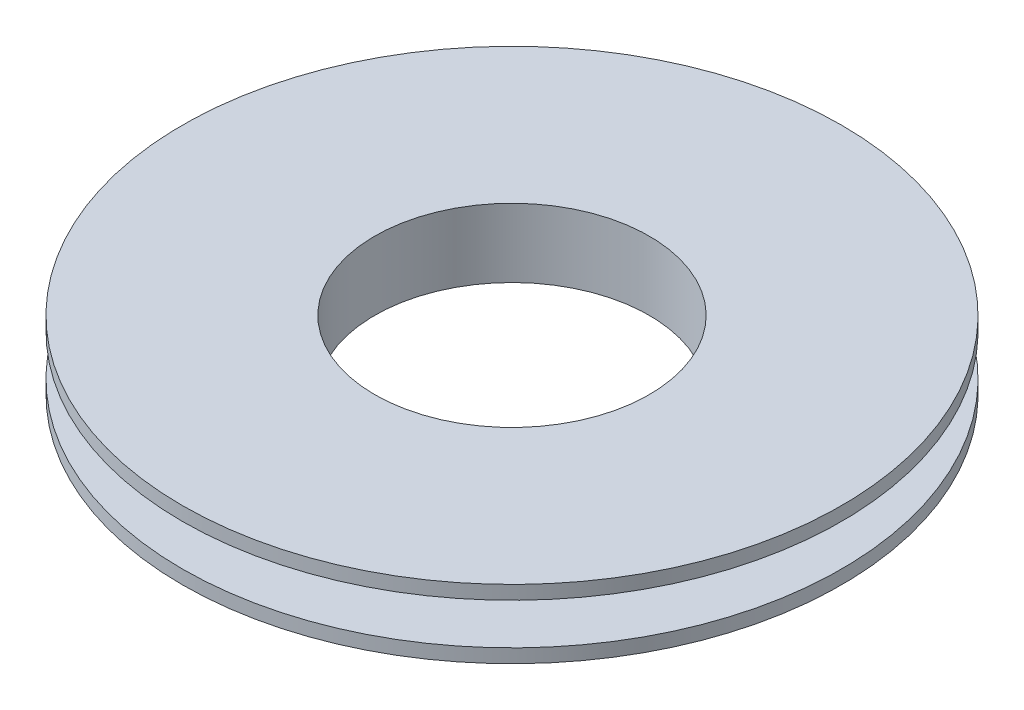
from build123d import *

# Parameters (mm, degrees)
SKETCH_2_R      = 7
SKETCH_2_R_2    = 5
EXTRUDE_1_DEPTH = 2.5
EXTRUDE_START   = -0.5
SKETCH_3_R      = 12
SKETCH_3_R_2    = 7
EXTRUDE_2_DEPTH = 0.5
SKETCH_4_R      = 12
SKETCH_4_R_2    = 7
EXTRUDE_3_DEPTH = 0.5


with BuildPart() as part:
    # 草圖2 → 填料-伸長1 (new body)
    with BuildSketch(Plane(origin=(0, 0, 0), x_dir=(1, 0, 0), z_dir=(0, 1, 0))):
        with Locations(Location((0, 0, 0), (0, 0, 270))):
            Circle(SKETCH_2_R)
        with Locations(Location((0, 0, 0), (0, 0, 270))):
            Circle(SKETCH_2_R_2, mode=Mode.SUBTRACT)
    extrude(amount=EXTRUDE_1_DEPTH)

    # 草圖3 → 填料-伸長2 (add)
    with BuildSketch(Plane(origin=(0, 2.5, 0), x_dir=(1, 0, 0), z_dir=(0, 1, 0)).offset(EXTRUDE_START)):
        with Locations(Location((0, 0, 0), (0, 0, 270))):
            Circle(SKETCH_3_R)
        with Locations(Location((0, 0, 0), (0, 0, 270))):
            Circle(SKETCH_3_R_2, mode=Mode.SUBTRACT)
    extrude(amount=EXTRUDE_2_DEPTH)

    # 草圖4 → 填料-伸長3 (add)
    with BuildSketch(Plane.XZ):
        with Locations(Location((0, 0, 0), (0, 0, 90))):
            Circle(SKETCH_4_R)
        with Locations(Location((0, 0, 0), (0, 0, 270))):
            Circle(SKETCH_4_R_2, mode=Mode.SUBTRACT)
    extrude(amount=-EXTRUDE_3_DEPTH)


solid = part.part
